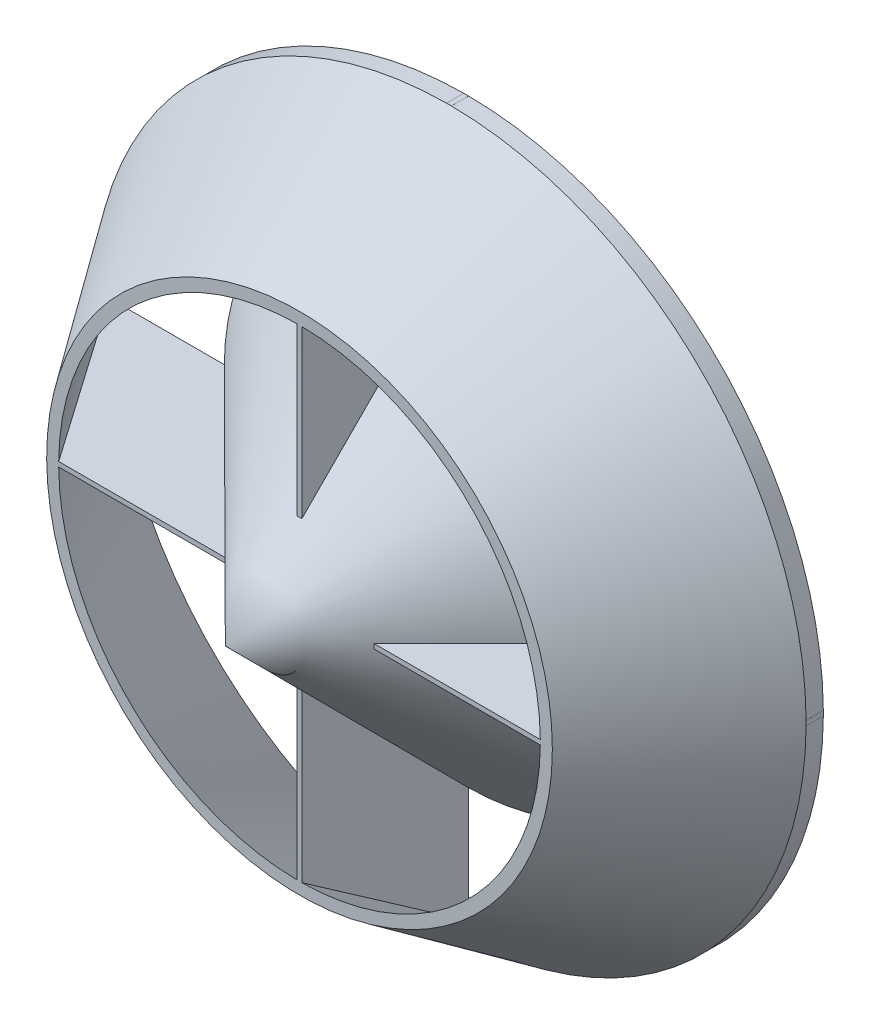
from build123d import *

# Parameters (mm, degrees)
BOSS_EXTRUDE1_DEPTH = 70


with BuildPart() as part:
    # Sketch1 → Revolve1 (revolve)
    with BuildSketch(Plane(origin=(0, 0, 0), x_dir=(0, 0, -1), z_dir=(1, 0, 0)), mode=Mode.PRIVATE) as revolve1_sk:
        Polygon((0, 101.6), (-101.15, 0), (-96.916744498, 0), (0, 97.347911428), align=None)
    revolve(revolve1_sk.sketch.rotate(Axis((0, 0, 101.15), (0, 0, -1)), 270), axis=Axis((0, 0, 101.15), (0, 0, -1)))

    # Sketch3 → Boss-Extrude1 (add)
    with BuildSketch(Plane.XY):
        Polygon((-1, 1), (-150, 1), (-150, -1), (-1, -1), (-1, -150), (1, -150), (1, -1), (150, -1), (150, 1), (1, 1), (1, 150), (-1, 150), align=None)
    extrude(amount=BOSS_EXTRUDE1_DEPTH)

    # Sketch5 → Cut-Revolve1 (revolve, cut)
    with BuildSketch(Plane(origin=(0, 0, 0), x_dir=(0, 0, -1), z_dir=(1, 0, 0))):
        Polygon((-96.916744498, 0), (6.133899753, 103.041259066), (0, 0), align=None)
    revolve(axis=Axis((0, 0, 0), (0, 0, 1)), mode=Mode.SUBTRACT)

    # Sketch6 → Revolve2 (revolve)
    with BuildSketch(Plane(origin=(0, 0, 0), x_dir=(0, 0, -1), z_dir=(1, 0, 0))):
        Polygon((0, 150), (-70, 101.145056725), (-70, 106.195161711), (-7.235856299, 150), align=None)
    revolve(axis=Axis((0, 0, 106.204880544), (0, 0, -1)))

    # Sketch7 → Cut-Revolve2 (revolve, cut)
    with BuildSketch(Plane(origin=(0, 0, 0), x_dir=(0, 0, -1), z_dir=(1, 0, 0)), mode=Mode.PRIVATE) as cut_revolve2_sk:
        Polygon((-7.235856299, 149.99666663), (-70, 106.190453294), (-70, 150), (-70, 151.803393864), (-4.647235207, 151.803393864), align=None)
    revolve(cut_revolve2_sk.sketch.rotate(Axis((0, 0, 108.547255844), (0, 0, -1)), 269.618033807), axis=Axis((0, 0, 108.547255844), (0, 0, -1)), mode=Mode.SUBTRACT)


solid = part.part
